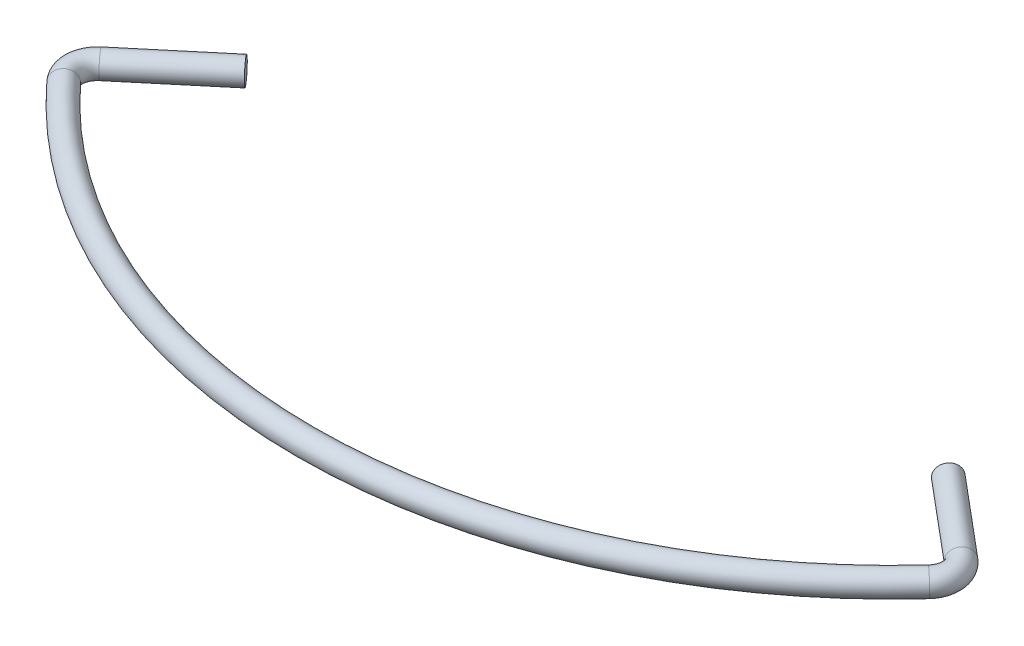
from build123d import *

# Parameters (mm, degrees)
LEFT_CROSS_SECTION_SKETCH_R   = 15
RIGHT_START                   = 100
RIGHT_CROSS_SECTION_SKETCH_R  = 15
RIGHT_JOINT_EXTRUDE_DEPTH     = 100
LEFT_CROSS_SECTION_SKETCH_2_R = 15
LEFT_JOINT_EXTRUDE_DEPTH      = 100


with BuildPart() as part:
    # Bar Sweep: sweep along a path in Overhead Sketch
    with BuildLine(Plane(origin=(0, 0, 0), x_dir=(1, 0, 0), z_dir=(0, 1, 0))) as bar_sweep_path:
        Line((517.079999105, -433.881636538), (539.572146309, -452.754788961))
        ThreePointArc((539.572146309, -452.754788961), (550.223234493, -473.758055128), (542.428454955, -495.980212564))
        ThreePointArc((542.428454955, -495.980212564), (0, -735), (-542.428454955, -495.980212564))
        ThreePointArc((-542.428454955, -495.980212564), (-550.223234493, -473.758055128), (-539.572146309, -452.754788961))
        Line((-539.572146309, -452.754788961), (-517.079999105, -433.881636538))
    # Left Cross Section Sketch → Bar Sweep (sweep)
    with BuildSketch(Plane(origin=(517.079999105, 0, 433.881636538), x_dir=(0.6427876096865377, 0, -0.7660444431189796), z_dir=(0.7660444431189796, 0, 0.6427876096865377))):
        Circle(LEFT_CROSS_SECTION_SKETCH_R)
    sweep(path=bar_sweep_path.line)

    # Right Cross Section Sketch → Right Joint Extrude (add)
    with BuildSketch(Plane(origin=(-517.079999105, 0, 433.881636538), x_dir=(-0.642787609686537, 0, -0.7660444431189801), z_dir=(0.7660444431189801, 0, -0.6427876096865369)).offset(RIGHT_START)):
        Circle(RIGHT_CROSS_SECTION_SKETCH_R)
    extrude(amount=-RIGHT_JOINT_EXTRUDE_DEPTH)

    # Left Cross Section Sketch<2> → Left Joint Extrude (add)
    with BuildSketch(Plane(origin=(517.079999105, 0, 433.881636538), x_dir=(0.6427876096865377, 0, -0.7660444431189796), z_dir=(0.7660444431189796, 0, 0.6427876096865377))):
        Circle(LEFT_CROSS_SECTION_SKETCH_2_R)
    extrude(amount=-LEFT_JOINT_EXTRUDE_DEPTH)


solid = part.part
